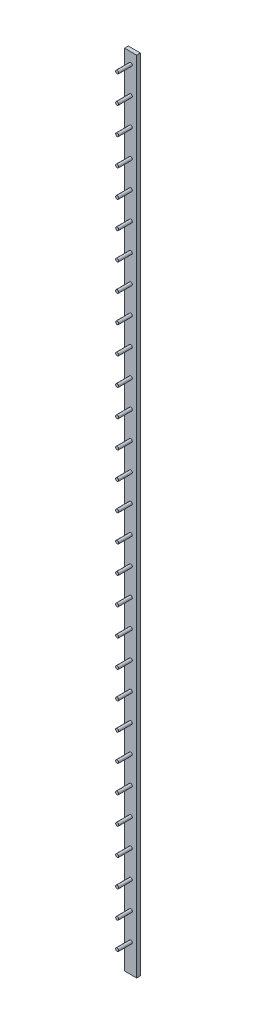
from build123d import *

# Parameters (mm, degrees)
SKETCH2_W           = 20.32
SKETCH2_H           = 1346.2
BOSS_EXTRUDE1_DEPTH = 6.35
SKETCH3_R           = 2.616420472
BOSS_EXTRUDE2_DEPTH = 22.86


with BuildPart() as part:
    # Sketch2 → Boss-Extrude1 (new body)
    with BuildSketch(Plane.XY):
        Rectangle(SKETCH2_W, SKETCH2_H)
    extrude(amount=BOSS_EXTRUDE1_DEPTH)

    # Sketch3 → Boss-Extrude2 (add)
    with BuildSketch(Plane.XY.offset(6.35)):
        with Locations((0.267312354, 654.853436839)):
            Circle(SKETCH3_R)
        with Locations((0.267312354, 609.133436839)):
            Circle(SKETCH3_R)
        with Locations((0.267312354, 563.413436839)):
            Circle(SKETCH3_R)
        with Locations((0.267312354, 517.693436839)):
            Circle(SKETCH3_R)
        with Locations((0.267312354, 471.973436839)):
            Circle(SKETCH3_R)
        with Locations((0.267312354, 426.253436839)):
            Circle(SKETCH3_R)
        with Locations((0.267312354, 380.533436839)):
            Circle(SKETCH3_R)
        with Locations((0.267312354, 334.813436839)):
            Circle(SKETCH3_R)
        with Locations((0.267312354, 289.093436839)):
            Circle(SKETCH3_R)
        with Locations((0.267312354, 243.373436839)):
            Circle(SKETCH3_R)
        with Locations((0.267312354, 197.653436839)):
            Circle(SKETCH3_R)
        with Locations((0.267312354, 151.933436839)):
            Circle(SKETCH3_R)
        with Locations((0.267312354, 106.213436839)):
            Circle(SKETCH3_R)
        with Locations((0.267312354, 60.493436839)):
            Circle(SKETCH3_R)
        with Locations((0.267312354, 14.773436839)):
            Circle(SKETCH3_R)
        with Locations((0.267312354, -30.946563161)):
            Circle(SKETCH3_R)
        with Locations((0.267312354, -76.666563161)):
            Circle(SKETCH3_R)
        with Locations((0.267312354, -122.386563161)):
            Circle(SKETCH3_R)
        with Locations((0.267312354, -168.106563161)):
            Circle(SKETCH3_R)
        with Locations((0.267312354, -213.826563161)):
            Circle(SKETCH3_R)
        with Locations((0.267312354, -259.546563161)):
            Circle(SKETCH3_R)
        with Locations((0.267312354, -305.266563161)):
            Circle(SKETCH3_R)
        with Locations((0.267312354, -350.986563161)):
            Circle(SKETCH3_R)
        with Locations((0.267312354, -396.706563161)):
            Circle(SKETCH3_R)
        with Locations((0.267312354, -442.426563161)):
            Circle(SKETCH3_R)
        with Locations((0.267312354, -488.146563161)):
            Circle(SKETCH3_R)
        with Locations((0.267312354, -533.866563161)):
            Circle(SKETCH3_R)
        with Locations((0.267312354, -579.586563161)):
            Circle(SKETCH3_R)
        with Locations((0.267312354, -625.306563161)):
            Circle(SKETCH3_R)
    extrude(amount=BOSS_EXTRUDE2_DEPTH)


solid = part.part
